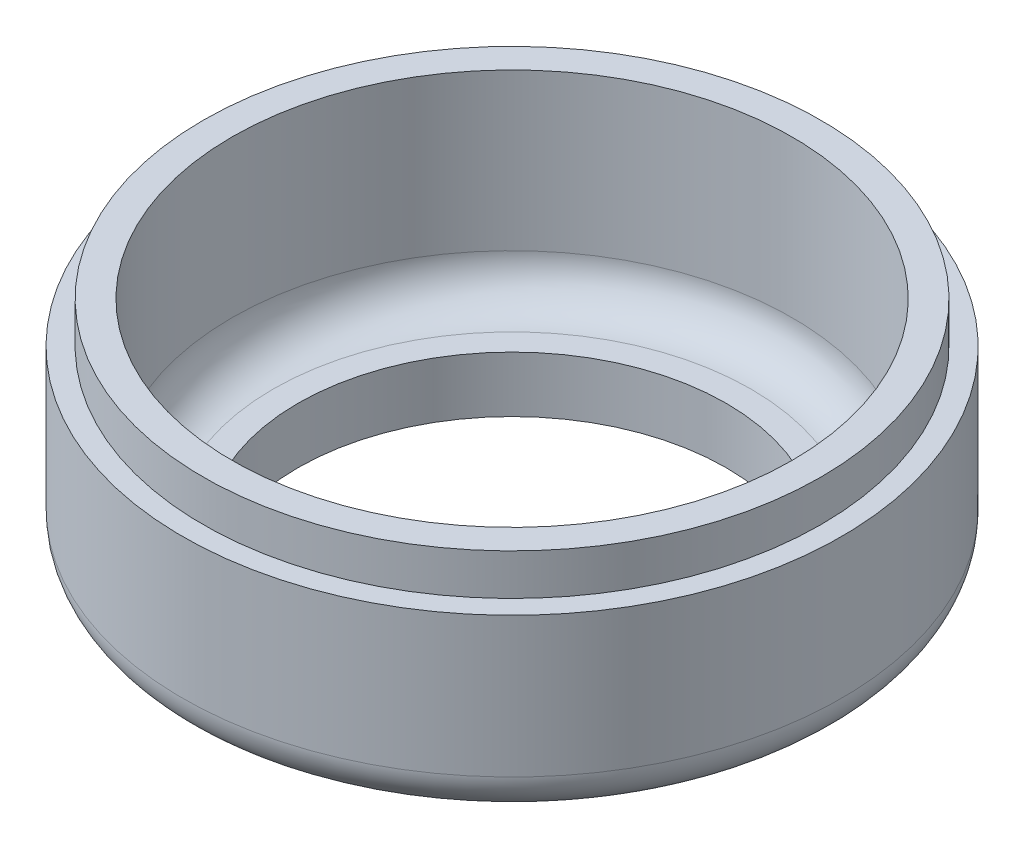
from build123d import *


with BuildPart() as part:
    # Sketch1 → Revolve1 (revolve)
    with BuildSketch(Plane.XY):
        with BuildLine():
            Line((-40, 8.79698141), (-40, -8.20301859))
            ThreePointArc((-40, -8.20301859), (-38.535533906, -11.738552496), (-35, -13.20301859))
            Line((-35, -13.20301859), (-29, -13.20301859))
            Line((-29, -13.20301859), (-29, -16.980259628))
            Line((-29, -16.980259628), (-26, -16.980259628))
            Line((-26, -16.980259628), (-26, -10.20301859))
            Line((-26, -10.20301859), (-29, -10.20301859))
            ThreePointArc((-29, -10.20301859), (-32.535533906, -8.738552496), (-34, -5.20301859))
            Line((-34, -5.20301859), (-34, 13.79698141))
            Line((-34, 13.79698141), (-37.5, 13.79698141))
            Line((-37.5, 13.79698141), (-37.5, 8.79698141))
            Line((-37.5, 8.79698141), (-40, 8.79698141))
        make_face()
    revolve(axis=Axis((0, 133.043372469, 0), (0, -1, 0)))


solid = part.part
